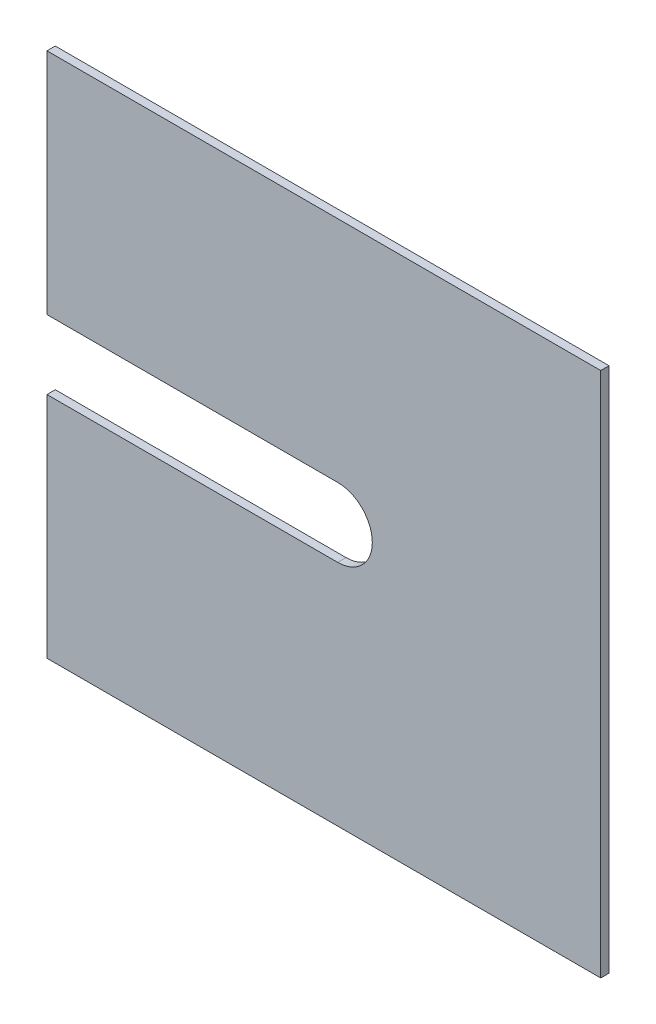
from build123d import *

# Parameters (mm, degrees)
CROQUIS1_W              = 200
CROQUIS1_H              = 190
SALIENTE_EXTRUIR1_DEPTH = 3
CORTAR_EXTRUIR1_DEPTH   = 3


with BuildPart() as part:
    # Croquis1 → Saliente-Extruir1 (new body)
    with BuildSketch(Plane.XY):
        Rectangle(CROQUIS1_W, CROQUIS1_H)
    extrude(amount=SALIENTE_EXTRUIR1_DEPTH)

    # Croquis2 → Cortar-Extruir1 (cut)
    with BuildSketch(Plane.XY.offset(3)):
        with BuildLine():
            Line((5, 12.5), (-100, 12.5))
            Line((-100, 12.5), (-100, 0))
            Line((-100, 0), (-100, -12.5))
            Line((-100, -12.5), (5, -12.5))
            ThreePointArc((5, -12.5), (17.5, 0), (5, 12.5))
        make_face()
    extrude(amount=-CORTAR_EXTRUIR1_DEPTH, mode=Mode.SUBTRACT)


solid = part.part
